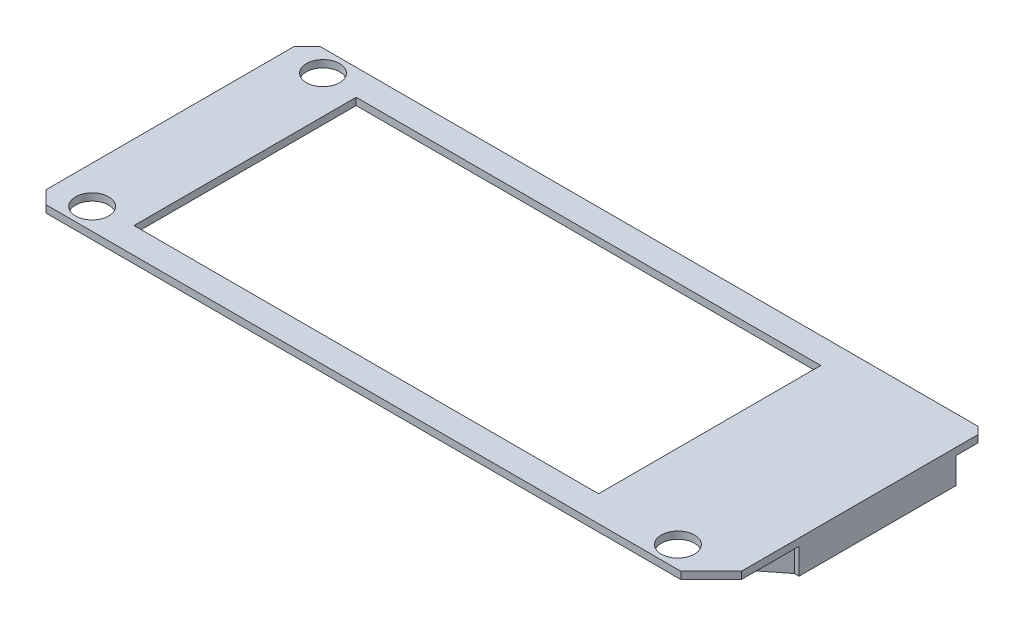
from build123d import *

# Parameters (mm, degrees)
EXTRUDE_1_DEPTH     = 0.5
EXTRUDE_2_DEPTH     = 0.5
SKETCH_3_W          = 32.2
SKETCH_3_H          = 15.4
EXTRUDE_3_DEPTH     = 0.5
EXTRUDE_4_DEPTH     = 1.8
SKETCH_7_R          = 1.15
CUT_EXTRUDE_1_DEPTH = 10


with BuildPart() as part:
    # Эскиз1 → Бобышка-Вытянуть1 (new body)
    with BuildSketch(Plane(origin=(0, 0, 0), x_dir=(1, 0, 0), z_dir=(0, 1, 0))):
        with BuildLine():
            Line((22.815864902, 9.839807024), (-22.784135098, 9.839807024))
            Line((-22.784135098, 9.839807024), (-23.684135098, 8.939807024))
            Line((-23.684135098, 8.939807024), (-23.684135098, -8.260192976))
            Line((-23.684135098, -8.260192976), (-22.784135098, -9.160192976))
            Line((-22.784135098, -9.160192976), (21.215864902, -9.160192976))
            Line((21.215864902, -9.160192976), (23.315864902, -7.060192976))
            Line((23.315864902, -7.060192976), (23.315864902, -3.260192976))
            Line((23.315864902, -3.260192976), (23.029007645, -3.260192976))
            ThreePointArc((23.029007645, -3.260192976), (22.159773793, -4.027024735), (21.188848248, -4.660192976))
            Line((21.188848248, -4.660192976), (21.188848248, -5.660192976))
            Line((21.188848248, -5.660192976), (19.888848248, -5.660192976))
            Line((19.888848248, -5.660192976), (19.888848248, -4.660192976))
            Line((19.888848248, -4.660192976), (17.315864902, -4.660192976))
            Line((17.315864902, -4.660192976), (17.315864902, -8.360192976))
            Line((17.315864902, -8.360192976), (-18.884135098, -8.360192976))
            Line((-18.884135098, -8.360192976), (-18.884135098, -6.660192976))
            Line((-18.884135098, -6.660192976), (-19.684135098, -5.860192976))
            Line((-19.684135098, -5.860192976), (-19.684135098, 6.539807024))
            Line((-19.684135098, 6.539807024), (-18.884135098, 7.339807024))
            Line((-18.884135098, 7.339807024), (-18.884135098, 9.039807024))
            Line((-18.884135098, 9.039807024), (17.315864902, 9.039807024))
            Line((17.315864902, 9.039807024), (17.315864902, 8.539807024))
            ThreePointArc((17.315864902, 8.539807024), (18.329503431, 8.456385882), (19.315864902, 8.208367324))
            Line((19.315864902, 8.208367324), (19.315864902, 9.139807024))
            Line((19.315864902, 9.139807024), (21.530126403, 9.139807024))
            ThreePointArc((21.530126403, 9.139807024), (22.315698775, 8.584938027), (23.029007645, 7.939807024))
            Line((23.029007645, 7.939807024), (23.315864902, 7.939807024))
            Line((23.315864902, 7.939807024), (23.315864902, 9.339807024))
            Line((23.315864902, 9.339807024), (22.815864902, 9.839807024))
        make_face()
        with BuildLine():
            ThreePointArc((18.565864902, -7.660192976), (19.515864902, -8.610192976), (20.465864902, -7.660192976))
            ThreePointArc((20.465864902, -7.660192976), (19.515864902, -6.710192976), (18.565864902, -7.660192976))
        make_face(mode=Mode.SUBTRACT)
        with BuildLine():
            ThreePointArc((-22.034135098, -7.660192976), (-21.084135098, -8.610192976), (-20.134135098, -7.660192976))
            ThreePointArc((-20.134135098, -7.660192976), (-21.084135098, -6.710192976), (-22.034135098, -7.660192976))
        make_face(mode=Mode.SUBTRACT)
        with BuildLine():
            ThreePointArc((-22.034135098, 8.339807024), (-21.084135098, 7.389807024), (-20.134135098, 8.339807024))
            ThreePointArc((-20.134135098, 8.339807024), (-21.084135098, 9.289807024), (-22.034135098, 8.339807024))
        make_face(mode=Mode.SUBTRACT)
    extrude(amount=EXTRUDE_1_DEPTH)

    # Эскиз2 → Бобышка-Вытянуть2 (add)
    with BuildSketch(Plane(origin=(0, 0, 0), x_dir=(-1, 0, 0), z_dir=(0, -1, 0))):
        Polygon((-17.315864902, -4.660192976), (-17.315864902, 9.839807024), (-22.815864902, 9.839807024), (-23.315864902, 9.339807024), (-23.315864902, -7.060192976), (-21.188848248, -5.660192976), (-17.315864902, -5.660192976), align=None)
    extrude(amount=-EXTRUDE_2_DEPTH)

    # Эскиз3 → Бобышка-Вытянуть3 (add)
    with BuildSketch(Plane(origin=(0, 0, 0), x_dir=(-1, 0, 0), z_dir=(0, -1, 0))):
        Polygon((18.884135098, -8.360192976), (18.884135098, -7.760192976), (19.728041262, -7.760192976), (19.728041262, 8.039807024), (18.884135098, 8.039807024), (18.884135098, 9.039807024), (-17.315864902, 9.039807024), (-17.315864902, -8.360192976), align=None)
        with Locations((2.384135098, 0.339807024)):
            Rectangle(SKETCH_3_W, SKETCH_3_H, mode=Mode.SUBTRACT)
    extrude(amount=-EXTRUDE_3_DEPTH)

    # Эскиз6 → Бобышка-Вытянуть4 (add)
    with BuildSketch(Plane(origin=(0, 0, 0), x_dir=(1, 0, 0), z_dir=(0, 1, 0))):
        Polygon((23.315864902, 7.821832851), (23.315864902, -3.062056468), (22.999687869, -3.062056468), (21.261580991, -4.424599137), (21.024758243, -4.424599137), (21.024758243, -5.416287347), (20.030773613, -5.416287347), (20.030773613, -4.424599137), (19.718020582, -4.424599137), (19.718020582, 8.99333189), (21.530126403, 8.99333189), (22.952461546, 7.821832851), align=None)
    extrude(amount=-EXTRUDE_4_DEPTH)

    # Эскиз7 → Вырез-Вытянуть1 (cut)
    with BuildSketch(Plane(origin=(0, 0.5, 0), x_dir=(1, 0, 0), z_dir=(0, 1, 0))):
        with Locations(Location((-21.084135098, 8.339807024, 0), (0, 0, 270))):
            Circle(SKETCH_7_R)
        with Locations(Location((-21.084135098, -7.660192976, 0), (0, 0, 270))):
            Circle(SKETCH_7_R)
        with Locations(Location((19.515864902, -7.660192976, 0), (0, 0, 270))):
            Circle(SKETCH_7_R)
    extrude(amount=-CUT_EXTRUDE_1_DEPTH, mode=Mode.SUBTRACT)


solid = part.part
